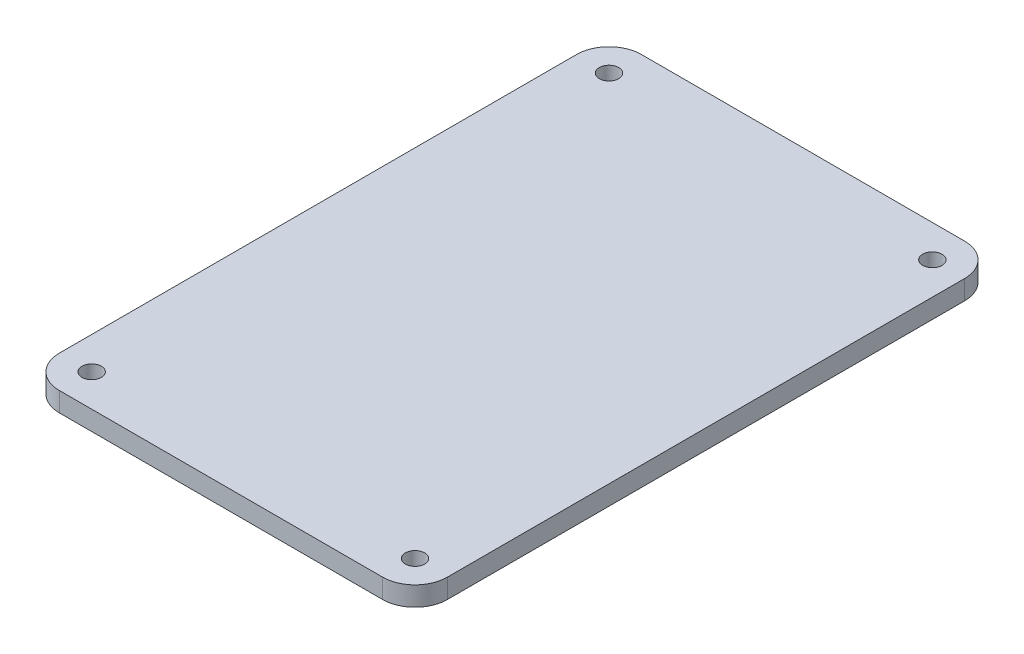
from build123d import *

# Parameters (mm, degrees)
SKETCH_1_R      = 1.5
EXTRUDE_1_DEPTH = 3


with BuildPart() as part:
    # 草圖1 → 填料-伸長1 (new body)
    with BuildSketch(Plane(origin=(0, 0, 0), x_dir=(1, 0, 0), z_dir=(0, 1, 0))):
        with BuildLine():
            Line((-25, -45), (25, -45))
            ThreePointArc((25, -45), (28.535533906, -43.535533906), (30, -40))
            Line((30, -40), (30, 40))
            ThreePointArc((30, 40), (28.535533906, 43.535533906), (25, 45))
            Line((25, 45), (-25, 45))
            ThreePointArc((-25, 45), (-28.535533906, 43.535533906), (-30, 40))
            Line((-30, 40), (-30, -40))
            ThreePointArc((-30, -40), (-28.535533906, -43.535533906), (-25, -45))
        make_face()
        with Locations(Location((-25, 40, 0), (0, 0, 270))):
            Circle(SKETCH_1_R, mode=Mode.SUBTRACT)
        with Locations(Location((25, 40, 0), (0, 0, 270))):
            Circle(SKETCH_1_R, mode=Mode.SUBTRACT)
        with Locations(Location((-25, -40, 0), (0, 0, 270))):
            Circle(SKETCH_1_R, mode=Mode.SUBTRACT)
        with Locations(Location((25, -40, 0), (0, 0, 270))):
            Circle(SKETCH_1_R, mode=Mode.SUBTRACT)
    extrude(amount=EXTRUDE_1_DEPTH)


solid = part.part
